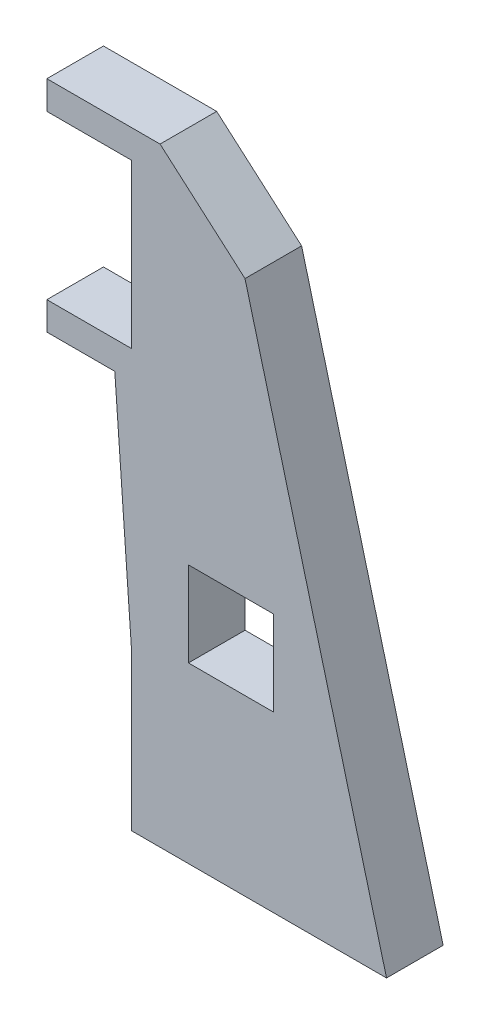
from build123d import *

# Parameters (mm, degrees)
BOSS_EXTRUDE1_DEPTH = 25.4
SKETCH2_W           = 38.1
SKETCH2_H           = 38.1
CUT_EXTRUDE1_DEPTH  = 303.885239179


with BuildPart() as part:
    # Sketch1 → Boss-Extrude1 (new body)
    with BuildSketch(Plane.XY):
        Polygon((0, 0), (0, 12.7), (50.8, 12.7), (88.9, -20.510228633), (152.4, -260.515926793), (38.018659419, -260.515926793), (38.018659419, -190.696503564), (30.48, -85.763926793), (0, -85.763926793), (0, -73.152260366), (38.018659419, -73.152260366), (38.018659419, 0), align=None)
    extrude(amount=BOSS_EXTRUDE1_DEPTH)

    # Sketch2 → Cut-Extrude1 (cut, through all)
    with BuildSketch(Plane(origin=(0, 0, 0), x_dir=(-1, 0, 0), z_dir=(0, 0, -1))):
        with Locations((-82.574564704, -163.487926793)):
            Rectangle(SKETCH2_W, SKETCH2_H)
    extrude(amount=-CUT_EXTRUDE1_DEPTH, mode=Mode.SUBTRACT)


solid = part.part
